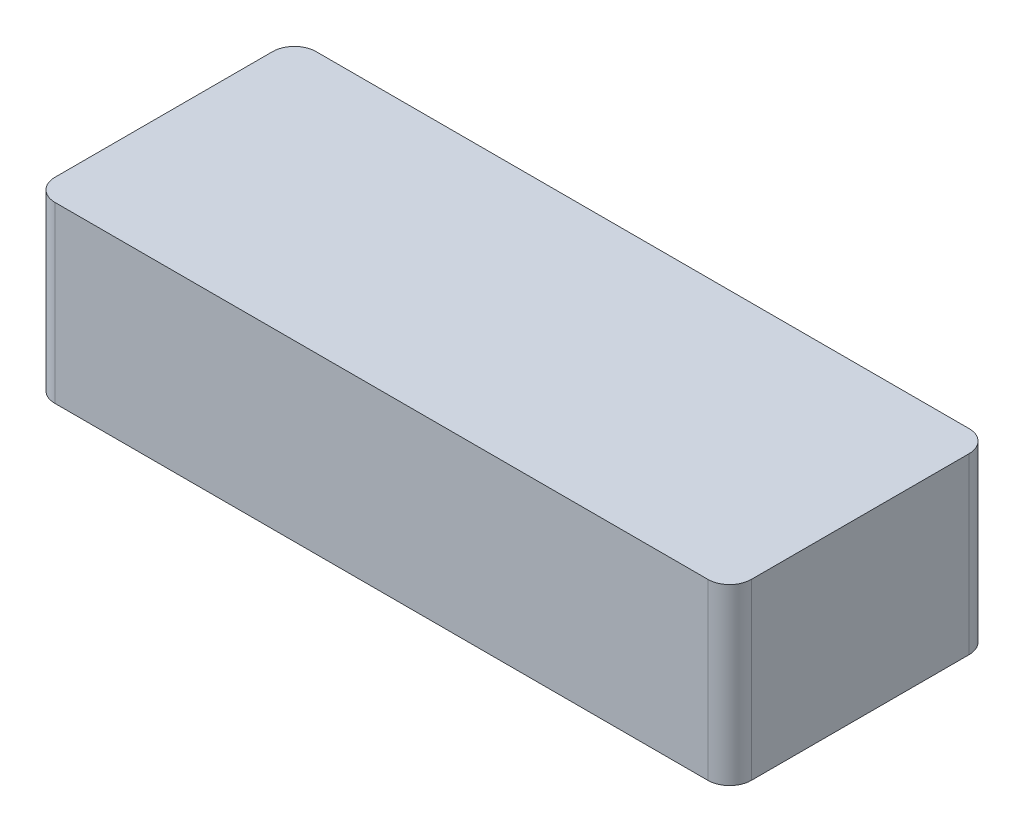
from build123d import *

# Parameters (mm, degrees)
SKETCH1_W           = 160
SKETCH1_H           = 60
BOSS_EXTRUDE1_DEPTH = 40
FILLET1_R           = 5


with BuildPart() as part:
    # Sketch1 → Boss-Extrude1 (new body)
    with BuildSketch(Plane(origin=(0, 0, 0), x_dir=(1, 0, 0), z_dir=(0, 1, 0))):
        Rectangle(SKETCH1_W, SKETCH1_H)
    extrude(amount=BOSS_EXTRUDE1_DEPTH)

    # Fillet1
    fillet1_edges = [part.edges().sort_by_distance(p)[0] for p in [
        (80, 20, 30),
        (-80, 20, 30),
        (-80, 20, -30),
        (80, 20, -30),
    ]]
    fillet(fillet1_edges, radius=FILLET1_R)


solid = part.part
